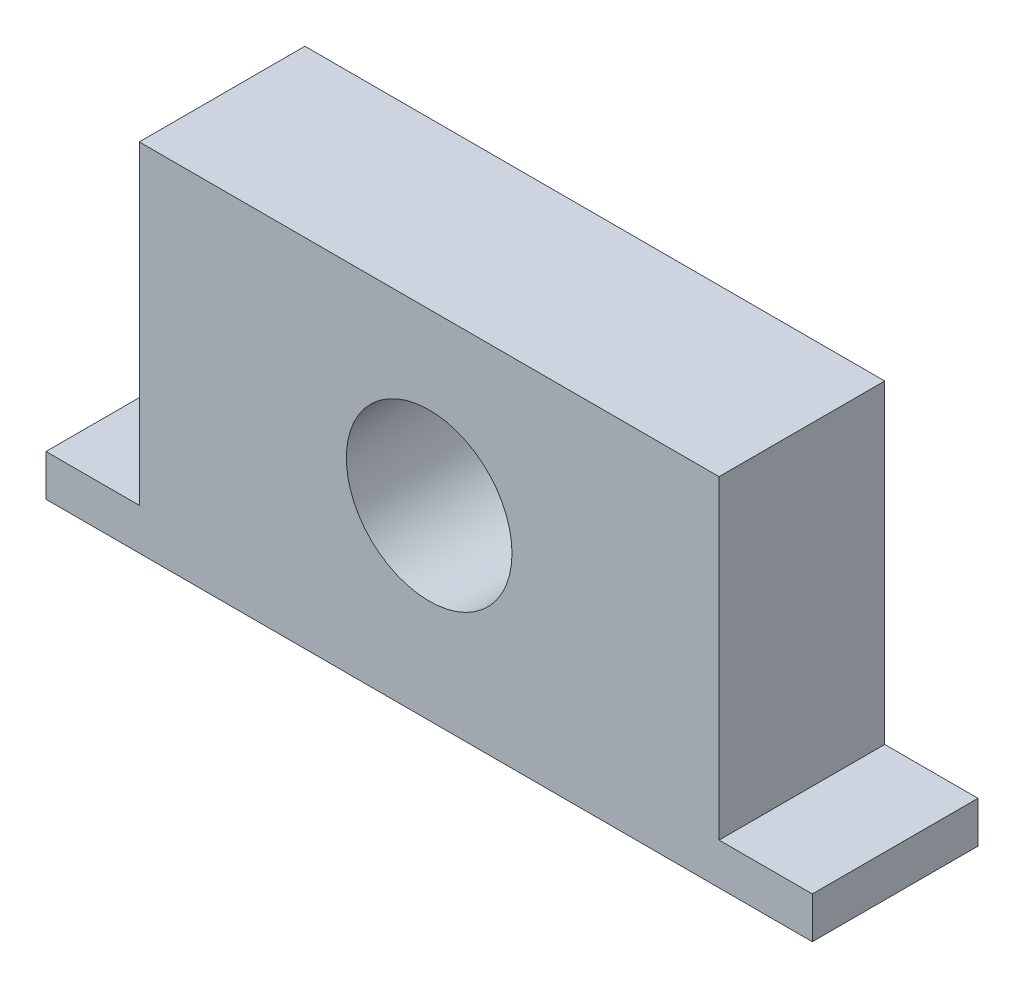
from build123d import *

# Parameters (mm, degrees)
SKETCH1_W           = 58.7502
SKETCH1_H           = 12.7
BOSS_EXTRUDE1_DEPTH = 3.175
SKETCH2_W           = 44.45
SKETCH2_H           = 12.7
BOSS_EXTRUDE2_DEPTH = 24.13
SKETCH3_R           = 6.35
CUT_EXTRUDE1_DEPTH  = 24.13


with BuildPart() as part:
    # Sketch1 → Boss-Extrude1 (new body)
    with BuildSketch(Plane(origin=(0, 0, 0), x_dir=(1, 0, 0), z_dir=(0, 1, 0))):
        with Locations((29.3751, 6.35)):
            Rectangle(SKETCH1_W, SKETCH1_H)
    extrude(amount=BOSS_EXTRUDE1_DEPTH)

    # Sketch2 → Boss-Extrude2 (add)
    with BuildSketch(Plane(origin=(0, 3.175, 0), x_dir=(1, 0, 0), z_dir=(0, 1, 0))):
        with Locations((29.3751, 6.35)):
            Rectangle(SKETCH2_W, SKETCH2_H)
    extrude(amount=BOSS_EXTRUDE2_DEPTH)

    # Sketch3 → Cut-Extrude1 (cut)
    with BuildSketch(Plane.XY):
        with Locations((29.3751, 14.2748)):
            Circle(SKETCH3_R)
    extrude(amount=-CUT_EXTRUDE1_DEPTH, mode=Mode.SUBTRACT)


solid = part.part
